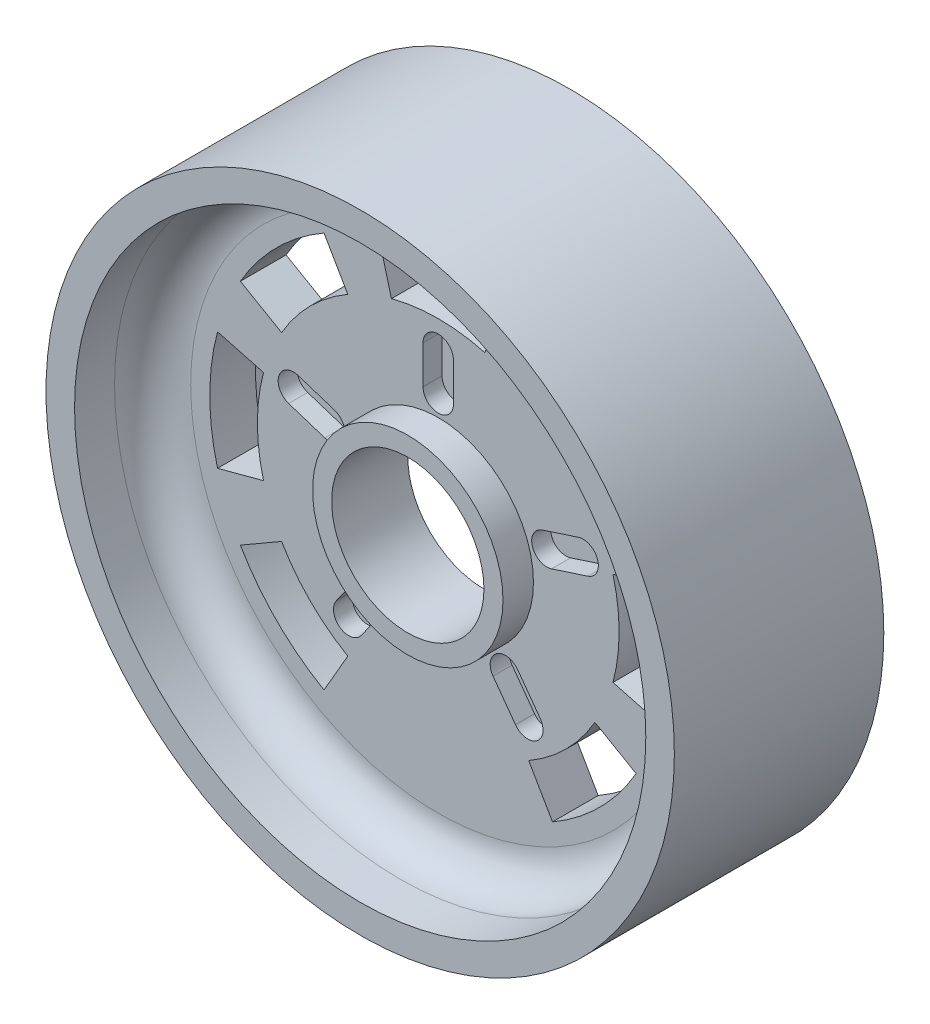
from build123d import *

# Parameters (mm, degrees)
CUT_EXTRUDE5_DEPTH = 62.806608676
CUT_EXTRUDE6_DEPTH = 2.54
CIRPATTERN1_COUNT  = 5
CIRPATTERN2_COUNT  = 8


with BuildPart() as part:
    # Sketch1 → Revolve1 (revolve)
    with BuildSketch(Plane(origin=(0, 0, 0), x_dir=(0, 0, -1), z_dir=(1, 0, 0))):
        with BuildLine():
            Line((0, 12.7), (0, 10.16))
            Line((0, 10.16), (10.16, 10.16))
            Line((10.16, 10.16), (10.16, 35.052))
            Line((10.16, 35.052), (21.59, 38.1))
            Line((21.59, 38.1), (21.59, 41.91))
            Line((21.59, 41.91), (-6.35, 41.91))
            Line((-6.35, 41.91), (-6.35, 38.1))
            Line((-6.35, 38.1), (-1.016, 38.1))
            ThreePointArc((-1.016, 38.1), (2.576102448, 36.612102448), (4.064, 33.02))
            Line((4.064, 33.02), (4.064, 12.7))
            Line((4.064, 12.7), (0, 12.7))
        make_face()
    revolve(axis=Axis((0, 0, 0), (0, 0, -1)))

    # Sketch2 → Cut-Extrude5 (cut, through all)
    with BuildSketch(Plane.XY.offset(-4.064)):
        with BuildLine():
            Line((-7.888804495, 29.441419185), (-6.245303558, 23.307790188))
            ThreePointArc((-6.245303558, 23.307790188), (0, 24.13), (6.245303558, 23.307790188))
            Line((6.245303558, 23.307790188), (7.888804495, 29.441419185))
            ThreePointArc((7.888804495, 29.441419185), (0, 30.48), (-7.888804495, 29.441419185))
        make_face()
    cut_extrude5 = extrude(amount=-CUT_EXTRUDE5_DEPTH, mode=Mode.SUBTRACT)

    # Sketch2<9> → Cut-Extrude6 (cut)
    with BuildSketch(Plane.XY.offset(-4.064)):
        with BuildLine():
            Line((2.032, 20.32), (2.032, 15.24))
            ThreePointArc((2.032, 15.24), (0, 13.208), (-2.032, 15.24))
            Line((-2.032, 15.24), (-2.032, 20.32))
            ThreePointArc((-2.032, 20.32), (0, 22.352), (2.032, 20.32))
        make_face()
    cut_extrude6 = extrude(amount=-CUT_EXTRUDE6_DEPTH, mode=Mode.SUBTRACT)

    # CirPattern1: Cut-Extrude6 ×5 about axis
    cirpattern1_axis = Axis((0, 0, 0), (0, 0, 1))
    for i in range(1, CIRPATTERN1_COUNT):
        add(cut_extrude6.rotate(cirpattern1_axis, i * 360 / CIRPATTERN1_COUNT), mode=Mode.SUBTRACT)

    # CirPattern2: Cut-Extrude5 ×8 about axis, 1 skipped
    cirpattern2_axis = Axis((0, 0, 0), (0, 0, 1))
    add([cut_extrude5.rotate(cirpattern2_axis, i * 360 / CIRPATTERN2_COUNT) for i in range(1, CIRPATTERN2_COUNT) if i not in (4,)], mode=Mode.SUBTRACT)


solid = part.part
